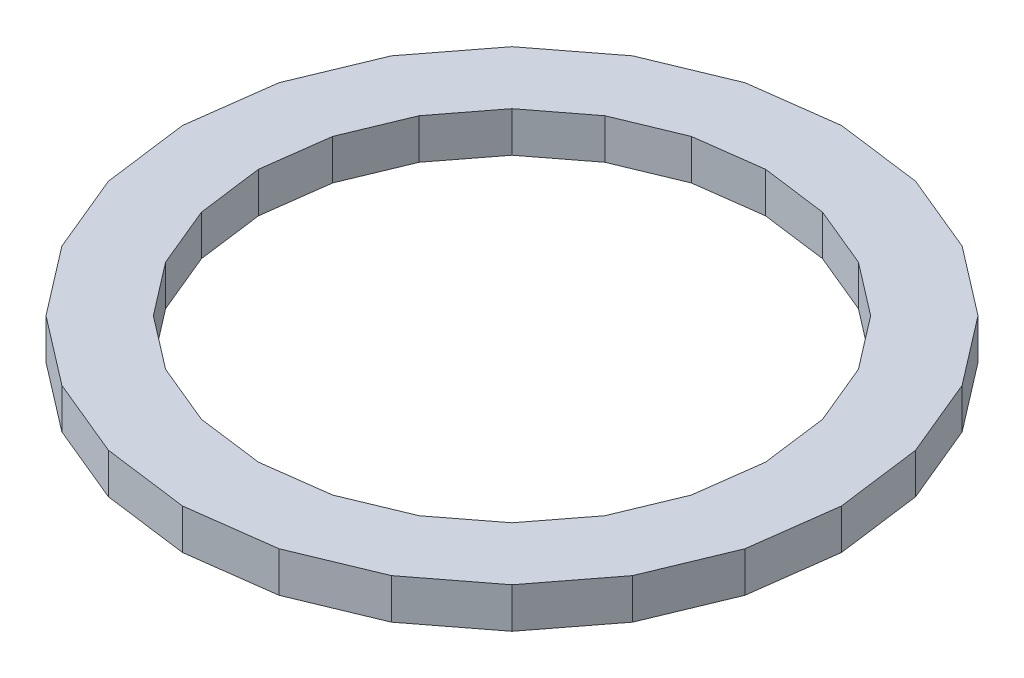
from build123d import *

# Parameters (mm, degrees)
BOSS_EXTRUDE3_DEPTH = 19.05


with BuildPart() as part:
    # Sketch3 → Boss-Extrude3 (new body)
    with BuildSketch(Plane(origin=(0, 0, 0), x_dir=(1, 0, 0), z_dir=(0, 1, 0))):
        Polygon((-155.677566735, 0), (-150.372982283, -40.292319166), (-134.820727592, -77.838783367), (-110.080663117, -110.080663117), (-77.838783367, -134.820727592), (-40.292319166, -150.372982283), (0, -155.677566735), (40.292319166, -150.372982283), (77.838783367, -134.820727592), (110.080663117, -110.080663117), (134.820727592, -77.838783367), (150.372982283, -40.292319166), (155.677566735, 0), (150.372982283, 40.292319166), (134.820727592, 77.838783367), (110.080663117, 110.080663117), (77.838783367, 134.820727592), (40.292319166, 150.372982283), (0, 155.677566735), (-40.292319166, 150.372982283), (-77.838783367, 134.820727592), (-110.080663117, 110.080663117), (-134.820727592, 77.838783367), (-150.372982283, 40.292319166), align=None)
        Polygon((-119.810720897, 0), (-115.72826958, -31.009296376), (-103.759127942, -59.905360448), (-84.718973205, -84.718973205), (-59.905360448, -103.759127942), (-31.009296376, -115.72826958), (0, -119.810720897), (31.009296376, -115.72826958), (59.905360448, -103.759127942), (84.718973205, -84.718973205), (103.759127942, -59.905360448), (115.72826958, -31.009296376), (119.810720897, 0), (115.72826958, 31.009296376), (103.759127942, 59.905360448), (84.718973205, 84.718973205), (59.905360448, 103.759127942), (31.009296376, 115.72826958), (0, 119.810720897), (-31.009296376, 115.72826958), (-59.905360448, 103.759127942), (-84.718973205, 84.718973205), (-103.759127942, 59.905360448), (-115.72826958, 31.009296376), align=None, mode=Mode.SUBTRACT)
    extrude(amount=BOSS_EXTRUDE3_DEPTH)


solid = part.part
